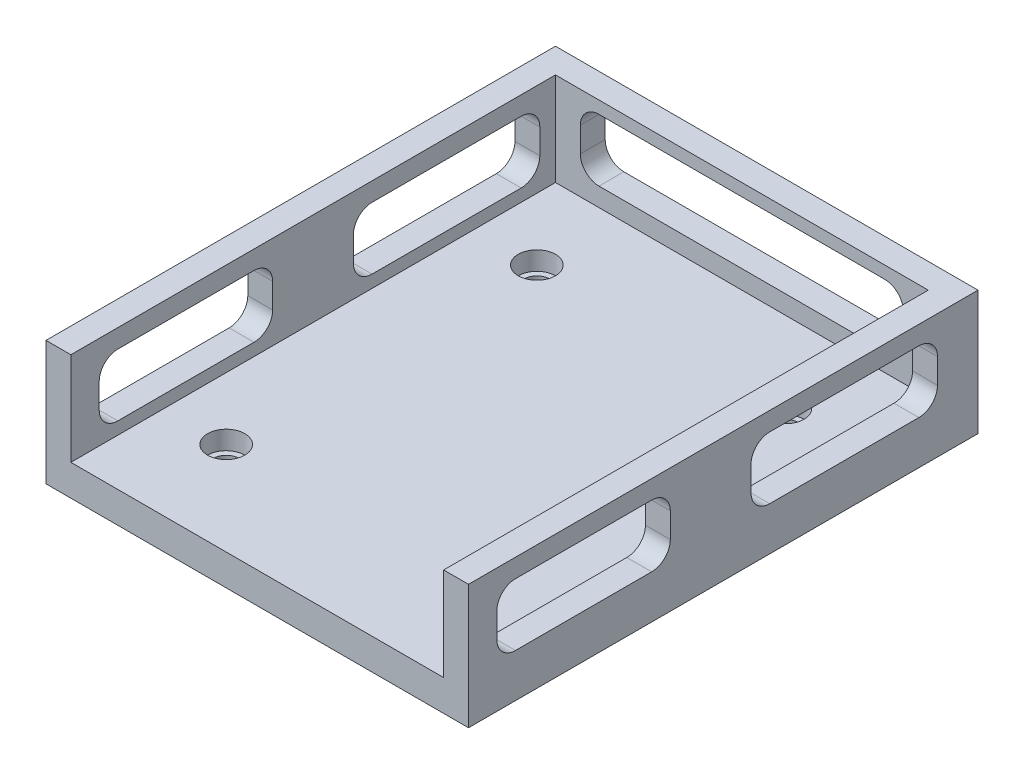
from build123d import *

# Parameters (mm, degrees)
EXTRUDE_1_DEPTH          = 5
EXTRUDE_2_DEPTH          = 15
EXTRUDE_2_DEPTH_BACK     = 5
SKETCH_3_R               = 3
CUT_EXTRUDE_1_DEPTH      = 3
SKETCH_4_R               = 2.1
CUT_EXTRUDE_2_DEPTH      = 10
CUT_EXTRUDE_3_DEPTH      = 86.718512573
CUT_EXTRUDE_3_DEPTH_BACK = 86.718512573
SKETCH_5_W               = 30
SKETCH_5_H               = 10
SKETCH_5_W_2             = 27.91179781
FILLET_1_R               = 3
CUT_EXTRUDE_4_DEPTH      = 88.407093534
CUT_EXTRUDE_4_DEPTH_BACK = 88.407093534
FILLET_2_R               = 3


with BuildPart() as part:
    # 草图1 → 凸台-拉伸1 (new body)
    with BuildSketch(Plane(origin=(0, 0, 0), x_dir=(1, 0, 0), z_dir=(0, 1, 0))):
        Polygon((0, 44.204391892), (-30, 44.204391892), (-30, -33.795608108), (0, -33.795608108), (30, -33.795608108), (30, 44.204391892), align=None)
    extrude(amount=EXTRUDE_1_DEPTH)

    # 草图2 → 凸台-拉伸2 (add, two sides: drawn at the far end of the back side and taken through both)
    with BuildSketch(Plane(origin=(0, 5, 0), x_dir=(1, 0, 0), z_dir=(0, 1, 0)).offset(-EXTRUDE_2_DEPTH_BACK)):
        Polygon((-30, -33.795608108), (-34, -33.795608108), (-34, 48.204391892), (34, 48.204391892), (34, -33.795608108), (30, -33.795608108), (30, 44.204391892), (-30, 44.204391892), align=None)
    extrude(amount=EXTRUDE_2_DEPTH + EXTRUDE_2_DEPTH_BACK)

    # 草图3 → 切除-拉伸1 (cut)
    with BuildSketch(Plane(origin=(0, 5, 0), x_dir=(1, 0, 0), z_dir=(0, 1, 0))):
        with Locations(Location((-20, 31.204391892, 0), (0, 0, 270))):
            Circle(SKETCH_3_R)
        with Locations(Location((20, 31.204391892, 0), (0, 0, 270))):
            Circle(SKETCH_3_R)
        with Locations(Location((-20, -18.795608108, 0), (0, 0, 270))):
            Circle(SKETCH_3_R)
        with Locations(Location((20, -18.795608108, 0), (0, 0, 270))):
            Circle(SKETCH_3_R)
    extrude(amount=-CUT_EXTRUDE_1_DEPTH, mode=Mode.SUBTRACT)

    # 草图4 → 切除-拉伸2 (cut)
    with BuildSketch(Plane(origin=(0, 2, 0), x_dir=(1, 0, 0), z_dir=(0, 1, 0))):
        with Locations(Location((-20, 31.204391892, 0), (0, 0, 270))):
            Circle(SKETCH_4_R)
        with Locations(Location((20, 31.204391892, 0), (0, 0, 270))):
            Circle(SKETCH_4_R)
        with Locations(Location((20, -18.795608108, 0), (0, 0, 270))):
            Circle(SKETCH_4_R)
        with Locations(Location((-20, -18.795608108, 0), (0, 0, 270))):
            Circle(SKETCH_4_R)
    extrude(amount=-CUT_EXTRUDE_2_DEPTH, mode=Mode.SUBTRACT)

    # 草图5 → 切除-拉伸3 (cut, two sides: drawn at the far end of the back side and taken through both)
    with BuildSketch(Plane.ZY.offset(34).offset(-CUT_EXTRUDE_3_DEPTH_BACK)):
        with Locations((-26.680193, 12)):
            Rectangle(SKETCH_5_W, SKETCH_5_H)
        with Locations((15.275705905, 12)):
            Rectangle(SKETCH_5_W_2, SKETCH_5_H)
    extrude(amount=CUT_EXTRUDE_3_DEPTH + CUT_EXTRUDE_3_DEPTH_BACK, mode=Mode.SUBTRACT)

    # 圆角1
    fillet_1_edges = [part.edges().sort_by_distance(p)[0] for p in [
        (-32, 17, -41.680193),
        (32, 17, -41.680193),
        (-32, 17, -11.680193),
        (32, 17, -11.680193),
        (-32, 7, -11.680193),
        (32, 7, -11.680193),
        (-32, 7, -41.680193),
        (32, 7, -41.680193),
        (-32, 17, 1.319807),
        (32, 17, 1.319807),
        (-32, 17, 29.23160481),
        (32, 17, 29.23160481),
        (-32, 7, 29.23160481),
        (32, 7, 29.23160481),
        (-32, 7, 1.319807),
        (32, 7, 1.319807),
    ]]
    fillet(fillet_1_edges, radius=FILLET_1_R)

    # 草图6 → 切除-拉伸4 (cut, two sides: drawn at the far end of the back side and taken through both)
    with BuildSketch(Plane.XY.offset(-44.204391892).offset(-CUT_EXTRUDE_4_DEPTH_BACK)):
        Polygon((0, 18), (-26, 18), (-26, 8), (26, 8), (26, 18), align=None)
    extrude(amount=CUT_EXTRUDE_4_DEPTH + CUT_EXTRUDE_4_DEPTH_BACK, mode=Mode.SUBTRACT)

    # 圆角2
    fillet_2_edges = [part.edges().sort_by_distance(p)[0] for p in [
        (26, 18, -46.204391892),
        (26, 8, -46.204391892),
        (-26, 8, -46.204391892),
        (-26, 18, -46.204391892),
    ]]
    fillet(fillet_2_edges, radius=FILLET_2_R)


solid = part.part
